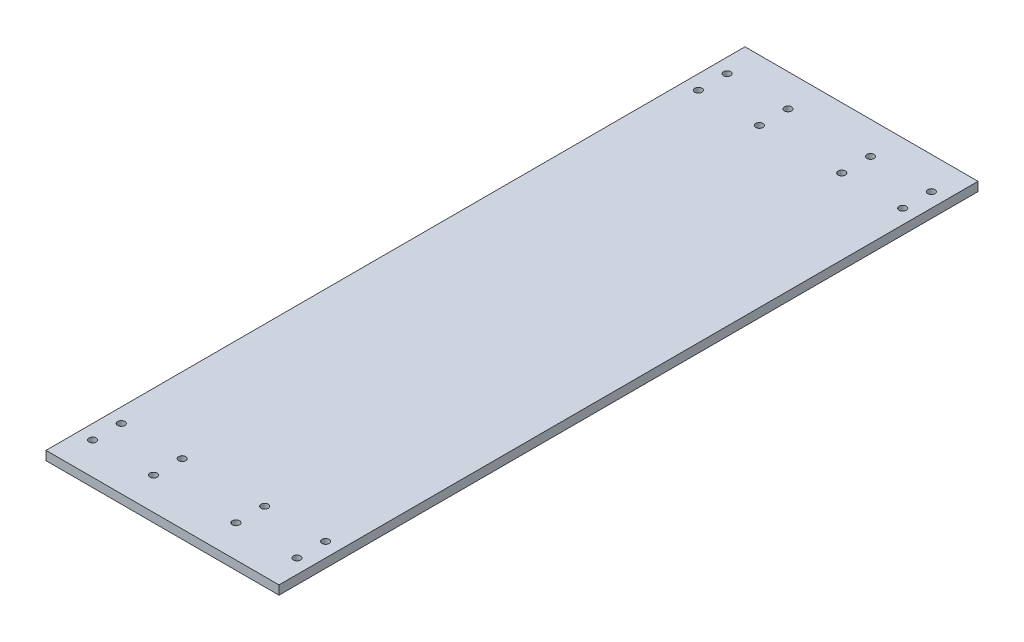
from build123d import *

# Parameters (mm, degrees)
SKETCH2_W                                  = 130
SKETCH2_H                                  = 390
BOSS_EXTRUDE1_DEPTH                        = 5
SKETCH3_R                                  = 2
CUT_EXTRUDE1_DEPTH                         = 10
MIRROR1_AT_THE_SECOND_PLANE_COPY_1_SKETC_R = 2
MIRROR1_AT_THE_SECOND_PLANE_COPY_1_DEPTH   = 10


with BuildPart() as part:
    # Sketch2 → Boss-Extrude1 (new body)
    with BuildSketch(Plane(origin=(0, 0, 0), x_dir=(1, 0, 0), z_dir=(0, 1, 0))):
        Rectangle(SKETCH2_W, SKETCH2_H)
    extrude(amount=BOSS_EXTRUDE1_DEPTH)

    # Sketch3 → Cut-Extrude1 (cut)
    with BuildSketch(Plane(origin=(0, 5, 0), x_dir=(1, 0, 0), z_dir=(0, 1, 0))):
        with Locations(Location((-57, 177, 0), (0, 0, 270))):
            Circle(SKETCH3_R)
        with Locations(Location((-57, 161, 0), (0, 0, 270))):
            Circle(SKETCH3_R)
        with Locations(Location((-23, 177, 0), (0, 0, 270))):
            Circle(SKETCH3_R)
        with Locations(Location((-23, 161, 0), (0, 0, 270))):
            Circle(SKETCH3_R)
    cut_extrude1 = extrude(amount=-CUT_EXTRUDE1_DEPTH, mode=Mode.SUBTRACT)

    # Mirror1: Cut-Extrude1 across plane
    add(cut_extrude1.mirror(Plane.XY), mode=Mode.SUBTRACT)

    # Mirror1 at the second plane: Cut-Extrude1 across plane
    add(cut_extrude1.mirror(Plane(origin=(0, 0, 0), x_dir=(0, 0, 1), z_dir=(1, 0, 0))), mode=Mode.SUBTRACT)

    # Mirror1 at the second plane copy 1 sketc → Mirror1 at the second plane copy 1 (cut)
    with BuildSketch(Plane(origin=(0, 5, 0), x_dir=(-1, 0, 0), z_dir=(0, 1, 0))):
        with Locations(Location((-57, 177, 0), (0, 0, 270))):
            Circle(MIRROR1_AT_THE_SECOND_PLANE_COPY_1_SKETC_R)
        with Locations(Location((-57, 161, 0), (0, 0, 270))):
            Circle(MIRROR1_AT_THE_SECOND_PLANE_COPY_1_SKETC_R)
        with Locations(Location((-23, 177, 0), (0, 0, 270))):
            Circle(MIRROR1_AT_THE_SECOND_PLANE_COPY_1_SKETC_R)
        with Locations(Location((-23, 161, 0), (0, 0, 270))):
            Circle(MIRROR1_AT_THE_SECOND_PLANE_COPY_1_SKETC_R)
    extrude(amount=-MIRROR1_AT_THE_SECOND_PLANE_COPY_1_DEPTH, mode=Mode.SUBTRACT)


solid = part.part
